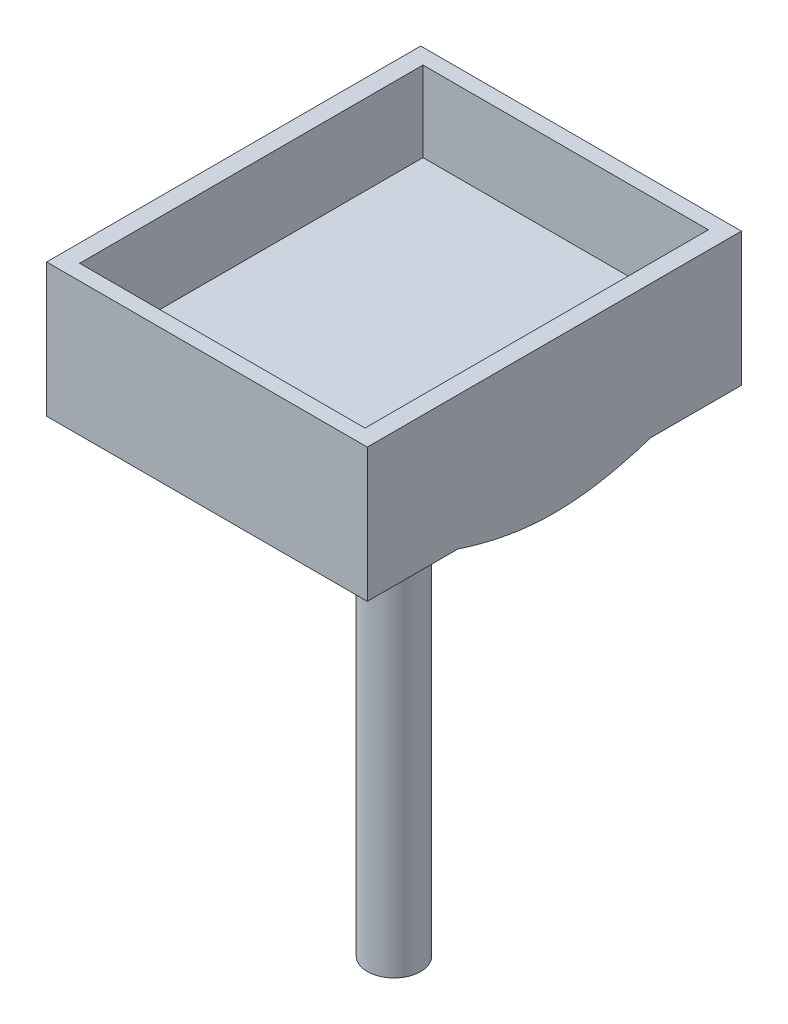
from build123d import *

# Parameters (mm, degrees)
SKETCH1_R               = 5
BOSS_EXTRUDE1_DEPTH     = 90
BOSS_EXTRUDE2_START     = 90
SKETCH2_W               = 60
SKETCH2_H               = 70
BOSS_EXTRUDE2_DEPTH     = 25
CUT_EXTRUDE1_DEPTH      = 126.199840255
CUT_EXTRUDE1_DEPTH_BACK = 126.199840255
SKETCH5_W               = 76.98796528
SKETCH5_H               = 79.307753312
SKETCH5_W_2             = 60
SKETCH5_H_2             = 70
CUT_EXTRUDE2_START      = 115
SKETCH6_W               = 53.399999872
SKETCH6_H               = 64.250000016
CUT_EXTRUDE2_DEPTH      = 15


with BuildPart() as part:
    # Sketch1 → Boss-Extrude1 (new body)
    with BuildSketch(Plane(origin=(0, 0, 0), x_dir=(1, 0, 0), z_dir=(0, 1, 0))):
        with Locations(Location((0, 0, 0), (0, 0, 90))):
            Circle(SKETCH1_R)
    extrude(amount=BOSS_EXTRUDE1_DEPTH)

    # Sketch2 → Boss-Extrude2 (add)
    with BuildSketch(Plane(origin=(0, 0, 0), x_dir=(1, 0, 0), z_dir=(0, 1, 0)).offset(BOSS_EXTRUDE2_START)):
        Rectangle(SKETCH2_W, SKETCH2_H)
    extrude(amount=BOSS_EXTRUDE2_DEPTH)

    # Sketch4 → Revolve1 (revolve)
    with BuildSketch(Plane(origin=(0, 0, 0), x_dir=(0, 0, -1), z_dir=(1, 0, 0)), mode=Mode.PRIVATE) as revolve1_sk:
        Polygon((-35, 90), (-5, 70.95), (-5, 90), align=None)
    revolve(revolve1_sk.sketch.rotate(Axis((0, 90, 0), (0, -1, 0)), 180), axis=Axis((0, 90, 0), (0, -1, 0)))

    # Sketch5 → Cut-Extrude1 (cut, two sides: drawn at the far end of the back side and taken through both)
    with BuildSketch(Plane(origin=(0, 0, 0), x_dir=(1, 0, 0), z_dir=(0, 1, 0)).offset(-CUT_EXTRUDE1_DEPTH_BACK)):
        Rectangle(SKETCH5_W, SKETCH5_H)
        Rectangle(SKETCH5_W_2, SKETCH5_H_2, mode=Mode.SUBTRACT)
    extrude(amount=CUT_EXTRUDE1_DEPTH + CUT_EXTRUDE1_DEPTH_BACK, mode=Mode.SUBTRACT)

    # Sketch6 → Cut-Extrude2 (cut)
    with BuildSketch(Plane(origin=(0, 0, 0), x_dir=(1, 0, 0), z_dir=(0, 1, 0)).offset(CUT_EXTRUDE2_START)):
        Rectangle(SKETCH6_W, SKETCH6_H)
    extrude(amount=-CUT_EXTRUDE2_DEPTH, mode=Mode.SUBTRACT)


solid = part.part
